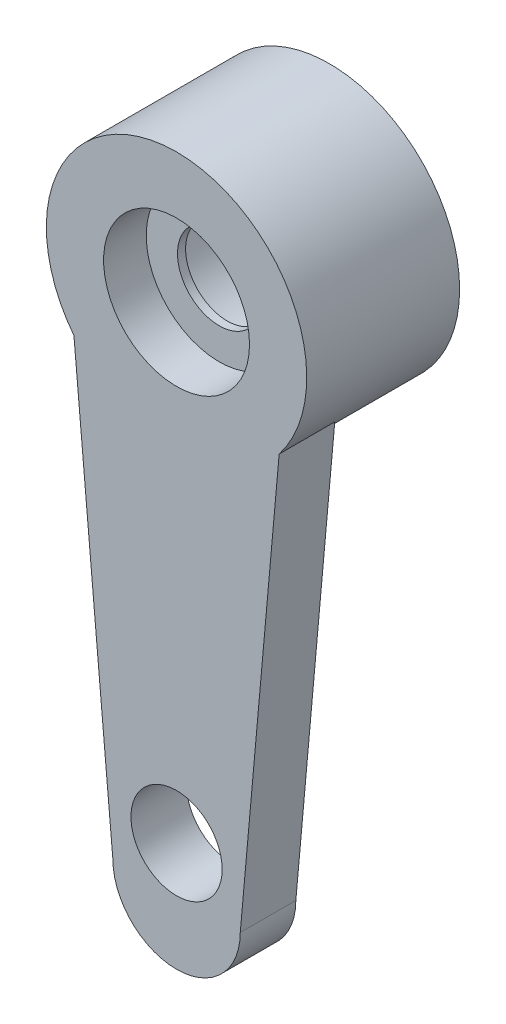
from build123d import *

# Parameters (mm, degrees)
SKETCH1_R           = 3.5687
SKETCH1_R_2         = 2
BOSS_EXTRUDE1_DEPTH = 4.191
SKETCH5_R           = 2
SKETCH5_R_2         = 1.143
BOSS_EXTRUDE2_DEPTH = 0.2226
BOSS_EXTRUDE3_START = -1.524
SKETCH6_R           = 1.25
BOSS_EXTRUDE3_DEPTH = 1.524


with BuildPart() as part:
    # Sketch1 → Boss-Extrude1 (new body)
    with BuildSketch(Plane.XY.offset(-7.032965862)):
        with Locations((-5.5, 0)):
            Circle(SKETCH1_R)
        with Locations((-5.5, 0)):
            Circle(SKETCH1_R_2, mode=Mode.SUBTRACT)
    extrude(amount=BOSS_EXTRUDE1_DEPTH)

    # Sketch5 → Boss-Extrude2 (add)
    with BuildSketch(Plane.XY.offset(-4.232965862)):
        with Locations((-5.5, 0)):
            Circle(SKETCH5_R)
        with Locations((-5.5, 0)):
            Circle(SKETCH5_R_2, mode=Mode.SUBTRACT)
    extrude(amount=BOSS_EXTRUDE2_DEPTH)

    # Sketch6 → Boss-Extrude3 (add)
    with BuildSketch(Plane.XY.offset(-2.841965862).offset(BOSS_EXTRUDE3_START)):
        with BuildLine():
            Line((-3.75375, -14.09065), (-2.68695, -2.195989387))
            ThreePointArc((-2.68695, -2.195989387), (-5.5, -3.5687), (-8.31305, -2.195989387))
            Line((-8.31305, -2.195989387), (-7.24625, -14.09065))
            ThreePointArc((-7.24625, -14.09065), (-5.5, -15.8369), (-3.75375, -14.09065))
        make_face()
        with Locations((-5.5, -12.84065)):
            Circle(SKETCH6_R, mode=Mode.SUBTRACT)
    extrude(amount=BOSS_EXTRUDE3_DEPTH)


solid = part.part
